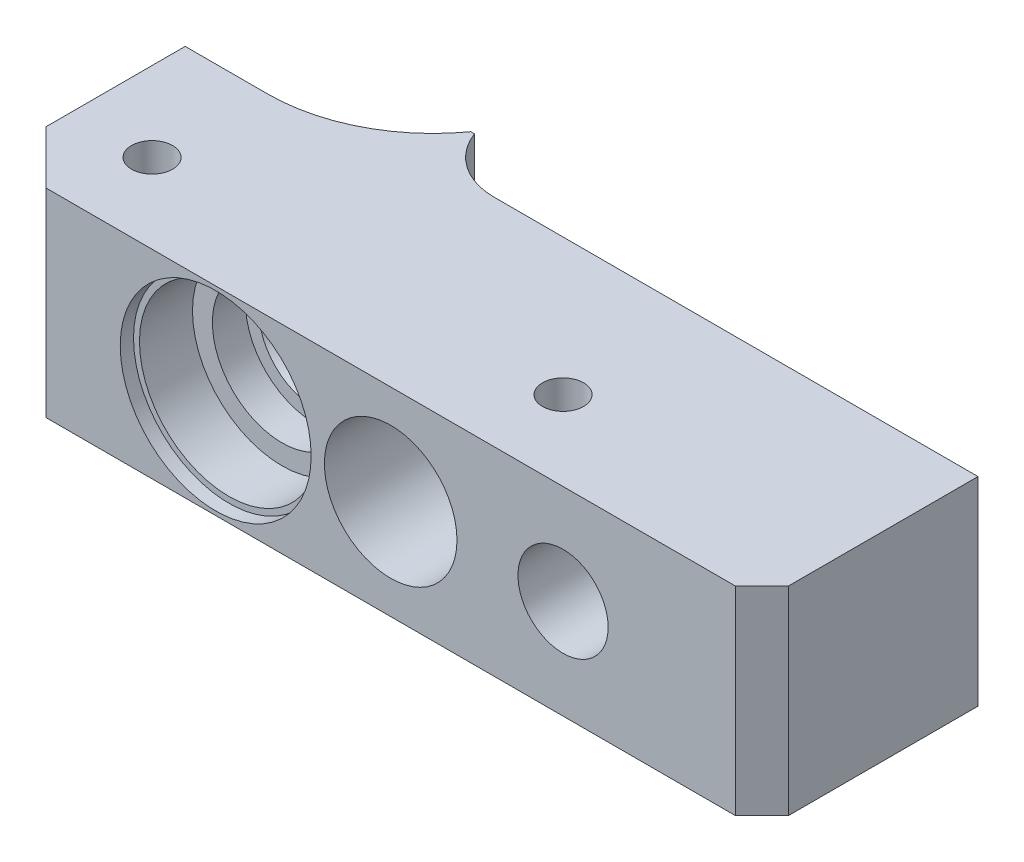
from build123d import *

# Parameters (mm, degrees)
CROQUIS1_W              = 58
CROQUIS1_H              = 12.5
CROQUIS1_R              = 1.55
SALIENTE_EXTRUIR1_DEPTH = 15
SALIENTE_EXTRUIR2_DEPTH = 15
CROQUIS2_R              = 2
CORTAR_EXTRUIR1_DEPTH   = 45.520669357
CROQUIS24_R             = 6.75
CORTAR_EXTRUIR10_DEPTH  = 5
CROQUIS25_R             = 5.25
CORTAR_EXTRUIR11_DEPTH  = 2.5
CROQUIS26_R             = 3.25
CORTAR_EXTRUIR12_DEPTH  = 7.5
TALADRO_ROSCADO_M81_D   = 6.8
CHAFL_N1_SIZE           = 4
CHAFL_N2_SIZE           = 2
CROQUIS34_R             = 5
CORTAR_EXTRUIR13_DEPTH  = 45.520669435
CHAFL_N3_SIZE           = 1
CHAFL_N3_SIZE2          = 1.732050808
CROQUIS35_R             = 7.2
CORTAR_EXTRUIR14_DEPTH  = 1


with BuildPart() as part:
    # Croquis1 → Saliente-Extruir1 (new body)
    with BuildSketch(Plane(origin=(0, 0, 0), x_dir=(1, 0, 0), z_dir=(0, 1, 0))):
        with Locations((-8, 0.25)):
            Rectangle(CROQUIS1_W, CROQUIS1_H)
        with Locations(Location((0, 0, 0), (0, 0, 270))):
            Circle(CROQUIS1_R, mode=Mode.SUBTRACT)
        with Locations(Location((-31, 0, 0), (0, 0, 270))):
            Circle(CROQUIS1_R, mode=Mode.SUBTRACT)
    extrude(amount=SALIENTE_EXTRUIR1_DEPTH)

    # Croquis5 → Saliente-Extruir2 (add)
    with BuildSketch(Plane(origin=(0, 0, 0), x_dir=(1, 0, 0), z_dir=(0, 1, 0))):
        with BuildLine():
            Line((21, 6.5), (21, 10.3))
            Line((21, 10.3), (-15.5, 10.3))
            ThreePointArc((-15.5, 10.3), (-18.473213749, 11.233854198), (-20.378524367, 13.7))
            Line((-20.378524367, 13.7), (-20.653079285, 13.7))
            ThreePointArc((-20.653079285, 13.7), (-25.099122875, 9.875702269), (-30.8, 8.5))
            Line((-30.8, 8.5), (-37, 8.5))
            Line((-37, 8.5), (-37, 6.5))
            Line((-37, 6.5), (21, 6.5))
        make_face()
    extrude(amount=SALIENTE_EXTRUIR2_DEPTH)

    # Croquis2 → Cortar-Extruir1 (cut, through all)
    with BuildSketch(Plane.XY.offset(6)):
        with Locations((-20.2, 7.5)):
            Circle(CROQUIS2_R)
    extrude(amount=-CORTAR_EXTRUIR1_DEPTH, mode=Mode.SUBTRACT)

    # Croquis24 → Cortar-Extruir10 (cut)
    with BuildSketch(Plane.XY.offset(6)):
        with Locations((-20.2, 7.5)):
            Circle(CROQUIS24_R)
    extrude(amount=-CORTAR_EXTRUIR10_DEPTH, mode=Mode.SUBTRACT)

    # Croquis25 → Cortar-Extruir11 (cut)
    with BuildSketch(Plane.XY.offset(1)):
        with Locations((-20.2, 7.5)):
            Circle(CROQUIS25_R)
    extrude(amount=-CORTAR_EXTRUIR11_DEPTH, mode=Mode.SUBTRACT)

    # Croquis26 → Cortar-Extruir12 (cut)
    with BuildSketch(Plane.XY.offset(-1.5)):
        with Locations((-20.2, 7.5)):
            Circle(CROQUIS26_R)
    extrude(amount=-CORTAR_EXTRUIR12_DEPTH, mode=Mode.SUBTRACT)

    # Taladro roscado M81 (through all)
    with Locations(Plane.XY.offset(6)):
        with Locations((6, 7.5)):
            Hole(TALADRO_ROSCADO_M81_D / 2)

    # Chaflán1
    chafl_n1_edges = [part.edges().sort_by_distance(p)[0] for p in [
        (-37, 7.5, 6),
    ]]
    chamfer(chafl_n1_edges, length=CHAFL_N1_SIZE)

    # Chaflán2
    chafl_n2_edges = [part.edges().sort_by_distance(p)[0] for p in [
        (21, 7.5, 6),
    ]]
    chamfer(chafl_n2_edges, length=CHAFL_N2_SIZE)

    # Croquis34 → Cortar-Extruir13 (cut, through all)
    with BuildSketch(Plane.XY.offset(6)):
        with Locations((-7, 7.5)):
            Circle(CROQUIS34_R)
    extrude(amount=-CORTAR_EXTRUIR13_DEPTH, mode=Mode.SUBTRACT)

    # Chaflán3
    chafl_n3_edges = [part.edges().sort_by_distance(p)[0] for p in [
        (-23.45, 7.5, -1.5),
    ]]
    chafl_n3_side = [part.faces().sort_by_distance(p)[0] for p in [
        (-25.301507576, 7.5, -1.5),
    ]]
    chamfer(chafl_n3_edges, length=CHAFL_N3_SIZE, length2=CHAFL_N3_SIZE2, reference=chafl_n3_side[0])

    # Croquis35 → Cortar-Extruir14 (cut)
    with BuildSketch(Plane.XY.offset(6)):
        with Locations((-20.2, 7.5)):
            Circle(CROQUIS35_R)
    extrude(amount=-CORTAR_EXTRUIR14_DEPTH, mode=Mode.SUBTRACT)


solid = part.part
